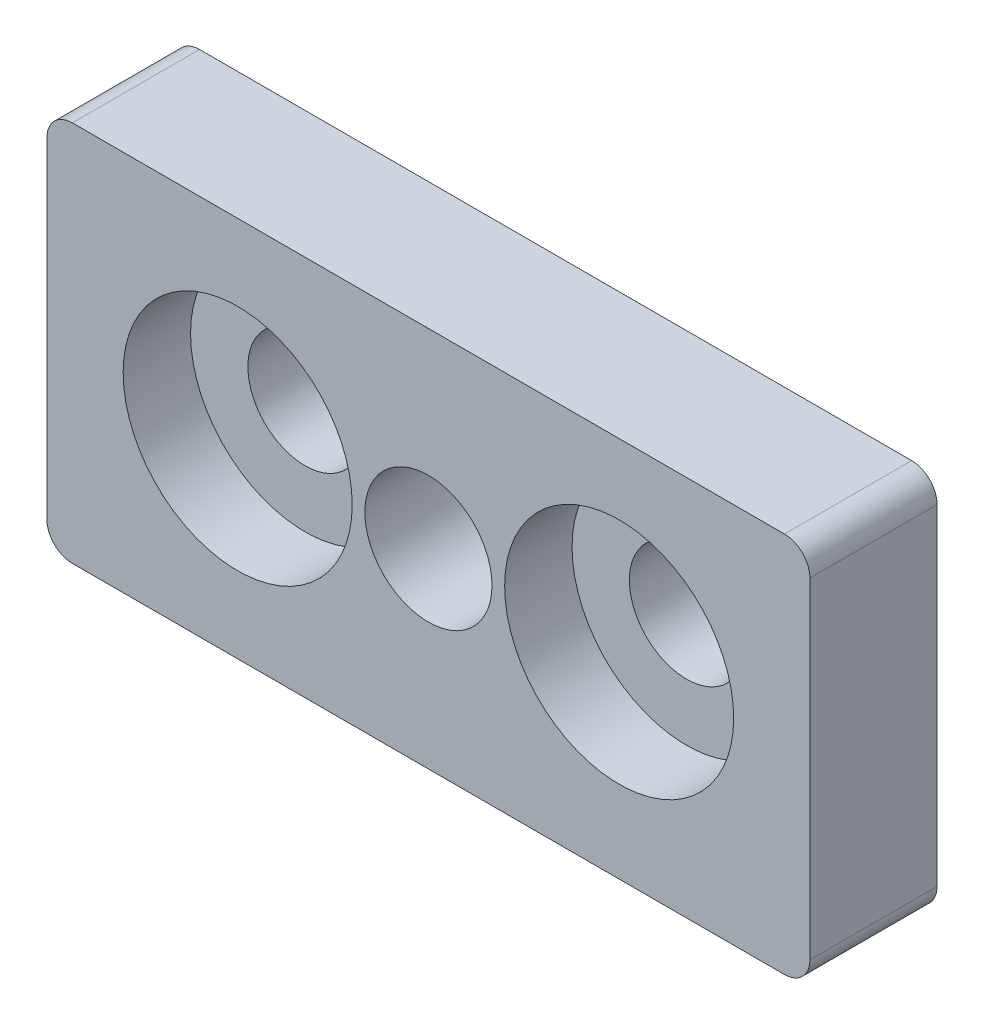
from build123d import *

# Parameters (mm, degrees)
SKETCH1_W                               = 60
SKETCH1_H                               = 30
BOSS_EXTRUDE1_DEPTH                     = 10
F_10_0_10_DIAMETER_HOLE1_D              = 10
CBORE_FOR_M8_HEX_HEAD_BOLT1_D           = 9
CBORE_FOR_M8_HEX_HEAD_BOLT1_CBORE_D     = 18.011
CBORE_FOR_M8_HEX_HEAD_BOLT1_CBORE_DEPTH = 5.3
FILLET1_R                               = 2


with BuildPart() as part:
    # Sketch1 → Boss-Extrude1 (new body)
    with BuildSketch(Plane.XY.offset(10)):
        Rectangle(SKETCH1_W, SKETCH1_H)
    extrude(amount=-BOSS_EXTRUDE1_DEPTH)

    # Ø10.0 (10) Diameter Hole1 (through all)
    with Locations(Plane.XY.offset(10)):
        with Locations((0, 0)):
            Hole(F_10_0_10_DIAMETER_HOLE1_D / 2)

    # CBORE for M8 Hex Head Bolt1 (through all)
    with Locations(Plane.XY.offset(10)):
        with Locations((-15, 0), (15, 0.462807071)):
            CounterBoreHole(CBORE_FOR_M8_HEX_HEAD_BOLT1_D / 2, CBORE_FOR_M8_HEX_HEAD_BOLT1_CBORE_D / 2, CBORE_FOR_M8_HEX_HEAD_BOLT1_CBORE_DEPTH)

    # Fillet1
    fillet1_edges = [part.edges().sort_by_distance(p)[0] for p in [
        (30, -15, 5),
        (-30, -15, 5),
        (-30, 15, 5),
        (30, 15, 5),
    ]]
    fillet(fillet1_edges, radius=FILLET1_R)


solid = part.part
